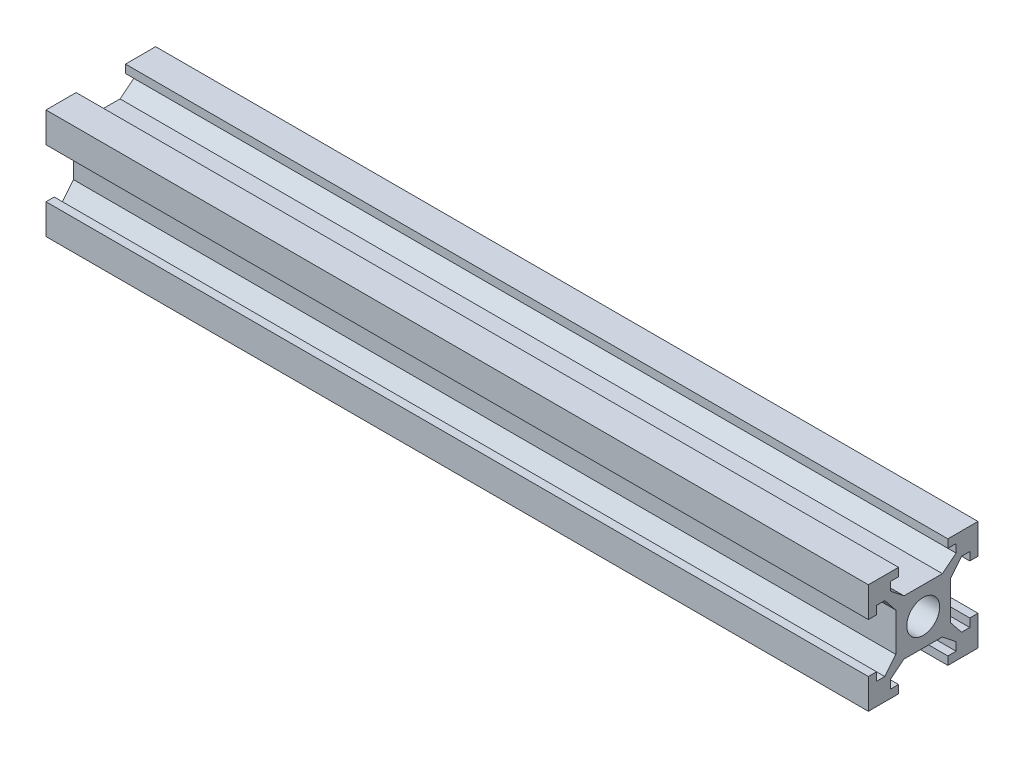
from build123d import *

# Parameters (mm, degrees)
SKETCH1_W           = 20
SKETCH1_H           = 20
BOSS_EXTRUDE1_DEPTH = 150
SKETCH2_R           = 3
CUT_EXTRUDE1_DEPTH  = 151.665191733
CUT_EXTRUDE2_DEPTH  = 151.665191733
CIRPATTERN1_COUNT   = 4


with BuildPart() as part:
    # Sketch1 → Boss-Extrude1 (new body)
    with BuildSketch(Plane(origin=(0, 0, 0), x_dir=(0, 0, -1), z_dir=(1, 0, 0))):
        Rectangle(SKETCH1_W, SKETCH1_H)
    extrude(amount=BOSS_EXTRUDE1_DEPTH)

    # Sketch2 → Cut-Extrude1 (cut, through all)
    with BuildSketch(Plane(origin=(150, 0, 0), x_dir=(0, 0, -1), z_dir=(1, 0, 0))):
        Circle(SKETCH2_R)
    extrude(amount=-CUT_EXTRUDE1_DEPTH, mode=Mode.SUBTRACT)

    # Sketch2<3> → Cut-Extrude2 (cut, through all)
    with BuildSketch(Plane(origin=(150, 0, 0), x_dir=(0, 0, -1), z_dir=(1, 0, 0))):
        Polygon((-3.5, 5), (3.5, 5), (6, 7), (6, 8.5), (4.5, 8.5), (4.5, 10), (-4.5, 10), (-4.5, 8.5), (-6, 8.5), (-6, 7), align=None)
    cut_extrude2 = extrude(amount=-CUT_EXTRUDE2_DEPTH, mode=Mode.SUBTRACT)

    # CirPattern1: Cut-Extrude2 ×4 about axis
    cirpattern1_axis = Axis((0, 0, 0), (1, 0, 0))
    for i in range(1, CIRPATTERN1_COUNT):
        add(cut_extrude2.rotate(cirpattern1_axis, i * 360 / CIRPATTERN1_COUNT), mode=Mode.SUBTRACT)


solid = part.part
